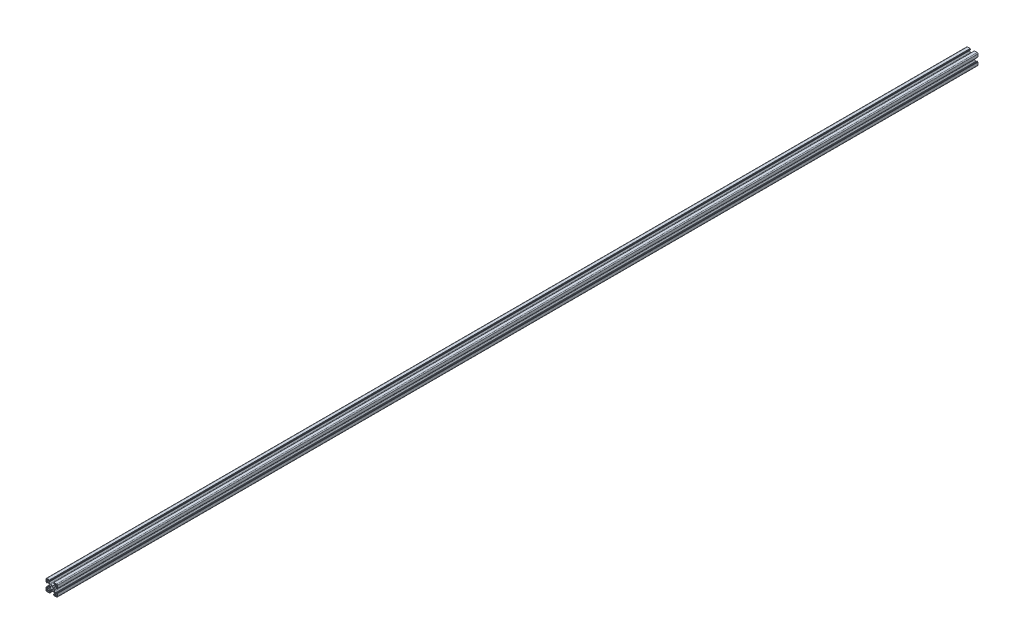
from build123d import *

# Parameters (mm, degrees)
EXTRUDE_1_DEPTH = 1620


with BuildPart() as part:
    # Эскиз1 → Бобышка-Вытянуть1 (new body)
    with BuildSketch(Plane.XY):
        with BuildLine():
            Line((0.259458272, 4.035699369), (2.158238941, 4.035699369))
            ThreePointArc((2.158238941, 4.035699369), (2.923605806, 4.187940304), (3.572452504, 4.621485807))
            Line((3.572452504, 4.621485807), (4.873671834, 5.922705138))
            ThreePointArc((4.873671834, 5.922705138), (5.307217337, 6.571551836), (5.459458272, 7.3369187))
            Line((5.459458272, 7.3369187), (5.459458272, 8.235699369))
            ThreePointArc((5.459458272, 8.235699369), (5.313011663, 8.58925276), (4.959458272, 8.735699369))
            Line((4.959458272, 8.735699369), (4.856565053, 8.735699369))
            ThreePointArc((4.856565053, 8.735699369), (4.665223337, 8.697639136), (4.503011663, 8.58925276))
            Line((4.503011663, 8.58925276), (4.022681577, 8.108922674))
            ThreePointArc((4.022681577, 8.108922674), (3.94157574, 8.054729486), (3.845904882, 8.035699369))
            Line((3.845904882, 8.035699369), (3.559458272, 8.035699369))
            ThreePointArc((3.559458272, 8.035699369), (3.382681577, 8.108922674), (3.309458272, 8.285699369))
            Line((3.309458272, 8.285699369), (3.309458272, 9.43477019))
            ThreePointArc((3.309458272, 9.43477019), (3.353392255, 9.540836207), (3.459458272, 9.58477019))
            Line((3.459458272, 9.58477019), (3.959458272, 9.58477019))
            Line((3.959458272, 9.58477019), (3.959458272, 9.885699369))
            ThreePointArc((3.959458272, 9.885699369), (4.003392255, 9.991765387), (4.109458272, 10.035699369))
            Line((4.109458272, 10.035699369), (8.759458272, 10.035699369))
            ThreePointArc((8.759458272, 10.035699369), (9.820118444, 9.596359541), (10.259458272, 8.535699369))
            Line((10.259458272, 8.535699369), (10.259458272, 3.885699369))
            ThreePointArc((10.259458272, 3.885699369), (10.215524289, 3.779633352), (10.109458272, 3.735699369))
            Line((10.109458272, 3.735699369), (9.808529093, 3.735699369))
            Line((9.808529093, 3.735699369), (9.808529093, 3.235699369))
            ThreePointArc((9.808529093, 3.235699369), (9.76459511, 3.129633352), (9.658529093, 3.085699369))
            Line((9.658529093, 3.085699369), (8.509458272, 3.085699369))
            ThreePointArc((8.509458272, 3.085699369), (8.332681577, 3.158922674), (8.259458272, 3.335699369))
            Line((8.259458272, 3.335699369), (8.259458272, 3.622145979))
            ThreePointArc((8.259458272, 3.622145979), (8.278488389, 3.717816837), (8.332681577, 3.798922674))
            Line((8.332681577, 3.798922674), (8.813011663, 4.27925276))
            ThreePointArc((8.813011663, 4.27925276), (8.921398038, 4.441464434), (8.959458272, 4.632806151))
            Line((8.959458272, 4.632806151), (8.959458272, 4.735699369))
            ThreePointArc((8.959458272, 4.735699369), (8.813011663, 5.08925276), (8.459458272, 5.235699369))
            Line((8.459458272, 5.235699369), (7.560677603, 5.235699369))
            ThreePointArc((7.560677603, 5.235699369), (6.795310738, 5.083458434), (6.146464041, 4.649912932))
            Line((6.146464041, 4.649912932), (4.84524471, 3.348693601))
            ThreePointArc((4.84524471, 3.348693601), (4.411699207, 2.699846903), (4.259458272, 1.934480039))
            Line((4.259458272, 1.934480039), (4.259458272, 0.035699369))
            Line((4.259458272, 0.035699369), (4.259458272, -1.8630813))
            ThreePointArc((4.259458272, -1.8630813), (4.411699207, -2.628448164), (4.84524471, -3.277294862))
            Line((4.84524471, -3.277294862), (6.146464041, -4.578514193))
            ThreePointArc((6.146464041, -4.578514193), (6.795310738, -5.012059696), (7.560677603, -5.164300631))
            Line((7.560677603, -5.164300631), (8.459458272, -5.164300631))
            ThreePointArc((8.459458272, -5.164300631), (8.813011663, -5.017854021), (8.959458272, -4.664300631))
            Line((8.959458272, -4.664300631), (8.959458272, -4.561407412))
            ThreePointArc((8.959458272, -4.561407412), (8.921398038, -4.370065696), (8.813011663, -4.207854021))
            Line((8.813011663, -4.207854021), (8.332681577, -3.727523935))
            ThreePointArc((8.332681577, -3.727523935), (8.278488389, -3.646418098), (8.259458272, -3.55074724))
            Line((8.259458272, -3.55074724), (8.259458272, -3.264300631))
            ThreePointArc((8.259458272, -3.264300631), (8.332681577, -3.087523935), (8.509458272, -3.014300631))
            Line((8.509458272, -3.014300631), (9.658529093, -3.014300631))
            ThreePointArc((9.658529093, -3.014300631), (9.76459511, -3.058234613), (9.808529093, -3.164300631))
            Line((9.808529093, -3.164300631), (9.808529093, -3.664300631))
            Line((9.808529093, -3.664300631), (10.109458272, -3.664300631))
            ThreePointArc((10.109458272, -3.664300631), (10.215524289, -3.708234613), (10.259458272, -3.814300631))
            Line((10.259458272, -3.814300631), (10.259458272, -8.464300631))
            ThreePointArc((10.259458272, -8.464300631), (9.820118444, -9.524960802), (8.759458272, -9.964300631))
            Line((8.759458272, -9.964300631), (4.109458272, -9.964300631))
            ThreePointArc((4.109458272, -9.964300631), (4.003392255, -9.920366648), (3.959458272, -9.814300631))
            Line((3.959458272, -9.814300631), (3.959458272, -9.513371451))
            Line((3.959458272, -9.513371451), (3.459458272, -9.513371451))
            ThreePointArc((3.459458272, -9.513371451), (3.353392255, -9.469437468), (3.309458272, -9.363371451))
            Line((3.309458272, -9.363371451), (3.309458272, -8.214300631))
            ThreePointArc((3.309458272, -8.214300631), (3.382681577, -8.037523935), (3.559458272, -7.964300631))
            Line((3.559458272, -7.964300631), (3.845904882, -7.964300631))
            ThreePointArc((3.845904882, -7.964300631), (3.94157574, -7.983330747), (4.022681577, -8.037523935))
            Line((4.022681577, -8.037523935), (4.503011663, -8.517854021))
            ThreePointArc((4.503011663, -8.517854021), (4.665223337, -8.626240397), (4.856565053, -8.664300631))
            Line((4.856565053, -8.664300631), (4.959458272, -8.664300631))
            ThreePointArc((4.959458272, -8.664300631), (5.313011663, -8.517854021), (5.459458272, -8.164300631))
            Line((5.459458272, -8.164300631), (5.459458272, -7.265519961))
            ThreePointArc((5.459458272, -7.265519961), (5.307217337, -6.500153097), (4.873671834, -5.851306399))
            Line((4.873671834, -5.851306399), (3.572452504, -4.550087068))
            ThreePointArc((3.572452504, -4.550087068), (2.923605806, -4.116541566), (2.158238941, -3.964300631))
            Line((2.158238941, -3.964300631), (0.259458272, -3.964300631))
            Line((0.259458272, -3.964300631), (-1.639322397, -3.964300631))
            ThreePointArc((-1.639322397, -3.964300631), (-2.404689262, -4.116541566), (-3.053535959, -4.550087068))
            Line((-3.053535959, -4.550087068), (-4.35475529, -5.851306399))
            ThreePointArc((-4.35475529, -5.851306399), (-4.788300793, -6.500153097), (-4.940541728, -7.265519961))
            Line((-4.940541728, -7.265519961), (-4.940541728, -8.164300631))
            ThreePointArc((-4.940541728, -8.164300631), (-4.794095118, -8.517854021), (-4.440541728, -8.664300631))
            Line((-4.440541728, -8.664300631), (-4.337648509, -8.664300631))
            ThreePointArc((-4.337648509, -8.664300631), (-4.146306793, -8.626240397), (-3.984095118, -8.517854021))
            Line((-3.984095118, -8.517854021), (-3.503765033, -8.037523935))
            ThreePointArc((-3.503765033, -8.037523935), (-3.422659195, -7.983330747), (-3.326988337, -7.964300631))
            Line((-3.326988337, -7.964300631), (-3.040541728, -7.964300631))
            ThreePointArc((-3.040541728, -7.964300631), (-2.863765033, -8.037523935), (-2.790541728, -8.214300631))
            Line((-2.790541728, -8.214300631), (-2.790541728, -9.363371451))
            ThreePointArc((-2.790541728, -9.363371451), (-2.834475711, -9.469437468), (-2.940541728, -9.513371451))
            Line((-2.940541728, -9.513371451), (-3.440541728, -9.513371451))
            Line((-3.440541728, -9.513371451), (-3.440541728, -9.814300631))
            ThreePointArc((-3.440541728, -9.814300631), (-3.484475711, -9.920366648), (-3.590541728, -9.964300631))
            Line((-3.590541728, -9.964300631), (-8.240541728, -9.964300631))
            ThreePointArc((-8.240541728, -9.964300631), (-9.3012019, -9.524960802), (-9.740541728, -8.464300631))
            Line((-9.740541728, -8.464300631), (-9.740541728, -3.814300631))
            ThreePointArc((-9.740541728, -3.814300631), (-9.696607745, -3.708234613), (-9.590541728, -3.664300631))
            Line((-9.590541728, -3.664300631), (-9.289612548, -3.664300631))
            Line((-9.289612548, -3.664300631), (-9.289612548, -3.164300631))
            ThreePointArc((-9.289612548, -3.164300631), (-9.245678566, -3.058234613), (-9.139612548, -3.014300631))
            Line((-9.139612548, -3.014300631), (-7.990541728, -3.014300631))
            ThreePointArc((-7.990541728, -3.014300631), (-7.813765033, -3.087523935), (-7.740541728, -3.264300631))
            Line((-7.740541728, -3.264300631), (-7.740541728, -3.55074724))
            ThreePointArc((-7.740541728, -3.55074724), (-7.759571845, -3.646418098), (-7.813765033, -3.727523935))
            Line((-7.813765033, -3.727523935), (-8.294095118, -4.207854021))
            ThreePointArc((-8.294095118, -4.207854021), (-8.402481494, -4.370065696), (-8.440541728, -4.561407412))
            Line((-8.440541728, -4.561407412), (-8.440541728, -4.664300631))
            ThreePointArc((-8.440541728, -4.664300631), (-8.294095118, -5.017854021), (-7.940541728, -5.164300631))
            Line((-7.940541728, -5.164300631), (-7.041761059, -5.164300631))
            ThreePointArc((-7.041761059, -5.164300631), (-6.276394194, -5.012059696), (-5.627547496, -4.578514193))
            Line((-5.627547496, -4.578514193), (-4.326328166, -3.277294862))
            ThreePointArc((-4.326328166, -3.277294862), (-3.892782663, -2.628448164), (-3.740541728, -1.8630813))
            Line((-3.740541728, -1.8630813), (-3.740541728, 0.035699369))
            Line((-3.740541728, 0.035699369), (-3.740541728, 1.934480039))
            ThreePointArc((-3.740541728, 1.934480039), (-3.892782663, 2.699846903), (-4.326328166, 3.348693601))
            Line((-4.326328166, 3.348693601), (-5.627547496, 4.649912932))
            ThreePointArc((-5.627547496, 4.649912932), (-6.276394194, 5.083458434), (-7.041761059, 5.235699369))
            Line((-7.041761059, 5.235699369), (-7.940541728, 5.235699369))
            ThreePointArc((-7.940541728, 5.235699369), (-8.294095118, 5.08925276), (-8.440541728, 4.735699369))
            Line((-8.440541728, 4.735699369), (-8.440541728, 4.632806151))
            ThreePointArc((-8.440541728, 4.632806151), (-8.402481494, 4.441464434), (-8.294095118, 4.27925276))
            Line((-8.294095118, 4.27925276), (-7.813765033, 3.798922674))
            ThreePointArc((-7.813765033, 3.798922674), (-7.759571845, 3.717816837), (-7.740541728, 3.622145979))
            Line((-7.740541728, 3.622145979), (-7.740541728, 3.335699369))
            ThreePointArc((-7.740541728, 3.335699369), (-7.813765033, 3.158922674), (-7.990541728, 3.085699369))
            Line((-7.990541728, 3.085699369), (-9.139612548, 3.085699369))
            ThreePointArc((-9.139612548, 3.085699369), (-9.245678566, 3.129633352), (-9.289612548, 3.235699369))
            Line((-9.289612548, 3.235699369), (-9.289612548, 3.735699369))
            Line((-9.289612548, 3.735699369), (-9.590541728, 3.735699369))
            ThreePointArc((-9.590541728, 3.735699369), (-9.696607745, 3.779633352), (-9.740541728, 3.885699369))
            Line((-9.740541728, 3.885699369), (-9.740541728, 8.535699369))
            ThreePointArc((-9.740541728, 8.535699369), (-9.3012019, 9.596359541), (-8.240541728, 10.035699369))
            Line((-8.240541728, 10.035699369), (-3.590541728, 10.035699369))
            ThreePointArc((-3.590541728, 10.035699369), (-3.484475711, 9.991765387), (-3.440541728, 9.885699369))
            Line((-3.440541728, 9.885699369), (-3.440541728, 9.58477019))
            Line((-3.440541728, 9.58477019), (-2.940541728, 9.58477019))
            ThreePointArc((-2.940541728, 9.58477019), (-2.834475711, 9.540836207), (-2.790541728, 9.43477019))
            Line((-2.790541728, 9.43477019), (-2.790541728, 8.285699369))
            ThreePointArc((-2.790541728, 8.285699369), (-2.863765033, 8.108922674), (-3.040541728, 8.035699369))
            Line((-3.040541728, 8.035699369), (-3.326988337, 8.035699369))
            ThreePointArc((-3.326988337, 8.035699369), (-3.422659195, 8.054729486), (-3.503765033, 8.108922674))
            Line((-3.503765033, 8.108922674), (-3.984095118, 8.58925276))
            ThreePointArc((-3.984095118, 8.58925276), (-4.146306793, 8.697639136), (-4.337648509, 8.735699369))
            Line((-4.337648509, 8.735699369), (-4.440541728, 8.735699369))
            ThreePointArc((-4.440541728, 8.735699369), (-4.794095118, 8.58925276), (-4.940541728, 8.235699369))
            Line((-4.940541728, 8.235699369), (-4.940541728, 7.3369187))
            ThreePointArc((-4.940541728, 7.3369187), (-4.788300793, 6.571551836), (-4.35475529, 5.922705138))
            Line((-4.35475529, 5.922705138), (-3.053535959, 4.621485807))
            ThreePointArc((-3.053535959, 4.621485807), (-2.404689262, 4.187940304), (-1.639322397, 4.035699369))
            Line((-1.639322397, 4.035699369), (0.259458272, 4.035699369))
        make_face()
        with BuildLine():
            Line((7.159458272, 6.135699369), (8.559458272, 6.135699369))
            ThreePointArc((8.559458272, 6.135699369), (9.125143697, 6.370013944), (9.359458272, 6.935699369))
            Line((9.359458272, 6.935699369), (9.359458272, 8.335699369))
            ThreePointArc((9.359458272, 8.335699369), (9.125143697, 8.901384794), (8.559458272, 9.135699369))
            Line((8.559458272, 9.135699369), (7.159458272, 9.135699369))
            ThreePointArc((7.159458272, 9.135699369), (6.593772847, 8.901384794), (6.359458272, 8.335699369))
            Line((6.359458272, 8.335699369), (6.359458272, 6.935699369))
            ThreePointArc((6.359458272, 6.935699369), (6.593772847, 6.370013944), (7.159458272, 6.135699369))
        make_face(mode=Mode.SUBTRACT)
        with BuildLine():
            Line((6.359458272, -6.864300631), (6.359458272, -8.264300631))
            ThreePointArc((6.359458272, -8.264300631), (6.593772847, -8.829986056), (7.159458272, -9.064300631))
            Line((7.159458272, -9.064300631), (8.559458272, -9.064300631))
            ThreePointArc((8.559458272, -9.064300631), (9.125143697, -8.829986056), (9.359458272, -8.264300631))
            Line((9.359458272, -8.264300631), (9.359458272, -6.864300631))
            ThreePointArc((9.359458272, -6.864300631), (9.125143697, -6.298615206), (8.559458272, -6.064300631))
            Line((8.559458272, -6.064300631), (7.159458272, -6.064300631))
            ThreePointArc((7.159458272, -6.064300631), (6.593772847, -6.298615206), (6.359458272, -6.864300631))
        make_face(mode=Mode.SUBTRACT)
        with BuildLine():
            Line((-6.640541728, -6.064300631), (-8.040541728, -6.064300631))
            ThreePointArc((-8.040541728, -6.064300631), (-8.606227153, -6.298615206), (-8.840541728, -6.864300631))
            Line((-8.840541728, -6.864300631), (-8.840541728, -8.264300631))
            ThreePointArc((-8.840541728, -8.264300631), (-8.606227153, -8.829986056), (-8.040541728, -9.064300631))
            Line((-8.040541728, -9.064300631), (-6.640541728, -9.064300631))
            ThreePointArc((-6.640541728, -9.064300631), (-6.074856303, -8.829986056), (-5.840541728, -8.264300631))
            Line((-5.840541728, -8.264300631), (-5.840541728, -6.864300631))
            ThreePointArc((-5.840541728, -6.864300631), (-6.074856303, -6.298615206), (-6.640541728, -6.064300631))
        make_face(mode=Mode.SUBTRACT)
        with BuildLine():
            Line((-5.840541728, 6.935699369), (-5.840541728, 8.335699369))
            ThreePointArc((-5.840541728, 8.335699369), (-6.074856303, 8.901384794), (-6.640541728, 9.135699369))
            Line((-6.640541728, 9.135699369), (-8.040541728, 9.135699369))
            ThreePointArc((-8.040541728, 9.135699369), (-8.606227153, 8.901384794), (-8.840541728, 8.335699369))
            Line((-8.840541728, 8.335699369), (-8.840541728, 6.935699369))
            ThreePointArc((-8.840541728, 6.935699369), (-8.606227153, 6.370013944), (-8.040541728, 6.135699369))
            Line((-8.040541728, 6.135699369), (-6.640541728, 6.135699369))
            ThreePointArc((-6.640541728, 6.135699369), (-6.074856303, 6.370013944), (-5.840541728, 6.935699369))
        make_face(mode=Mode.SUBTRACT)
        with BuildLine():
            ThreePointArc((2.759458272, 0.035699369), (2.027225225, 1.803466322), (0.259458272, 2.535699369))
            ThreePointArc((0.259458272, 2.535699369), (-1.508308681, 1.803466322), (-2.240541728, 0.035699369))
            ThreePointArc((-2.240541728, 0.035699369), (-1.508308681, -1.732067584), (0.259458272, -2.464300631))
            ThreePointArc((0.259458272, -2.464300631), (2.027225225, -1.732067584), (2.759458272, 0.035699369))
        make_face(mode=Mode.SUBTRACT)
    extrude(amount=EXTRUDE_1_DEPTH)


solid = part.part
